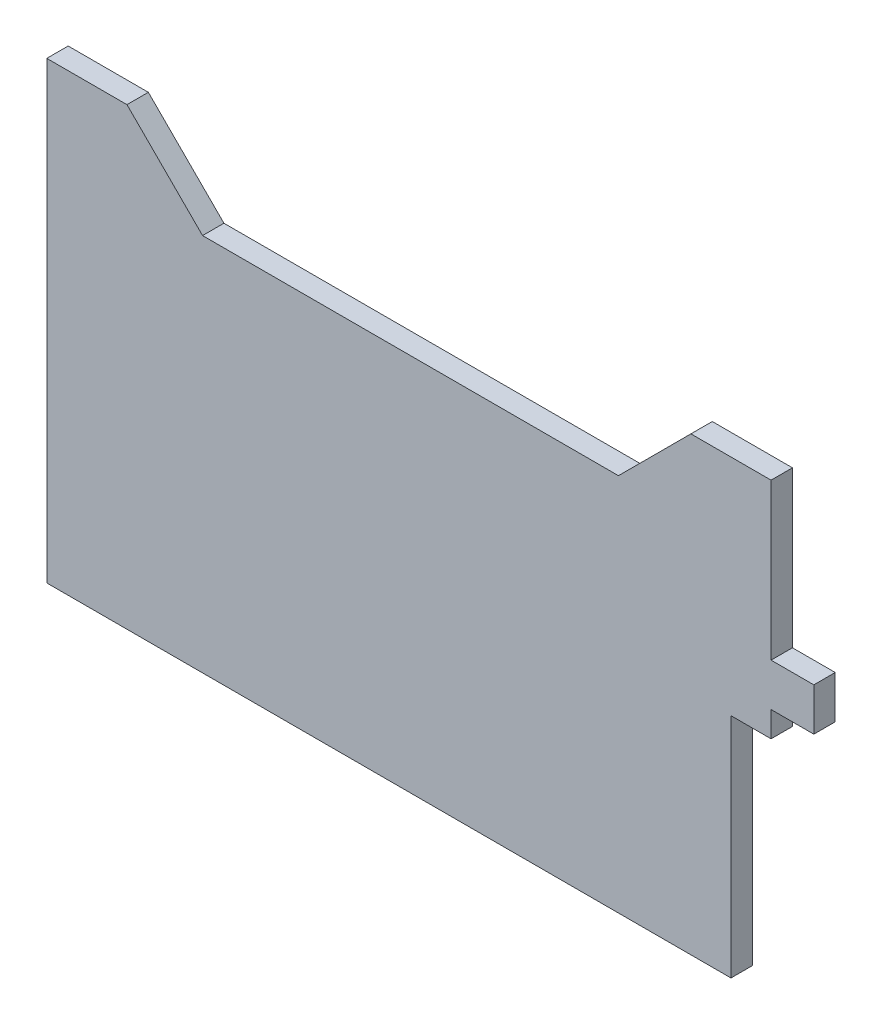
from build123d import *

# Parameters (mm, degrees)
BOSS_EXTRUDE1_DEPTH = 4
BOSS_EXTRUDE2_DEPTH = 4


with BuildPart() as part:
    # Sketch1 → Boss-Extrude1 (new body)
    with BuildSketch(Plane.XY):
        Polygon((47, 32.200893004), (54.5, 32.200893004), (54.5, 27.450893004), (62.5, 27.450893004), (62.5, 19.450893004), (54.5, 19.450893004), (54.5, 14.700893004), (47, 14.700893004), (47, -27.799106996), (-81, -27.799106996), (-81, 32.200893004), align=None)
    extrude(amount=BOSS_EXTRUDE1_DEPTH)

    # Sketch2 → Boss-Extrude2 (add)
    with BuildSketch(Plane.XY):
        Polygon((-81, 32.200893004), (54.5, 32.200893004), (54.5, 56.612431949), (39.5, 56.612431949), (25.946325432, 43.058757381), (-51.857864376, 43.058757381), (-66, 57.200893004), (-81, 57.200893004), align=None)
    extrude(amount=BOSS_EXTRUDE2_DEPTH)


solid = part.part
